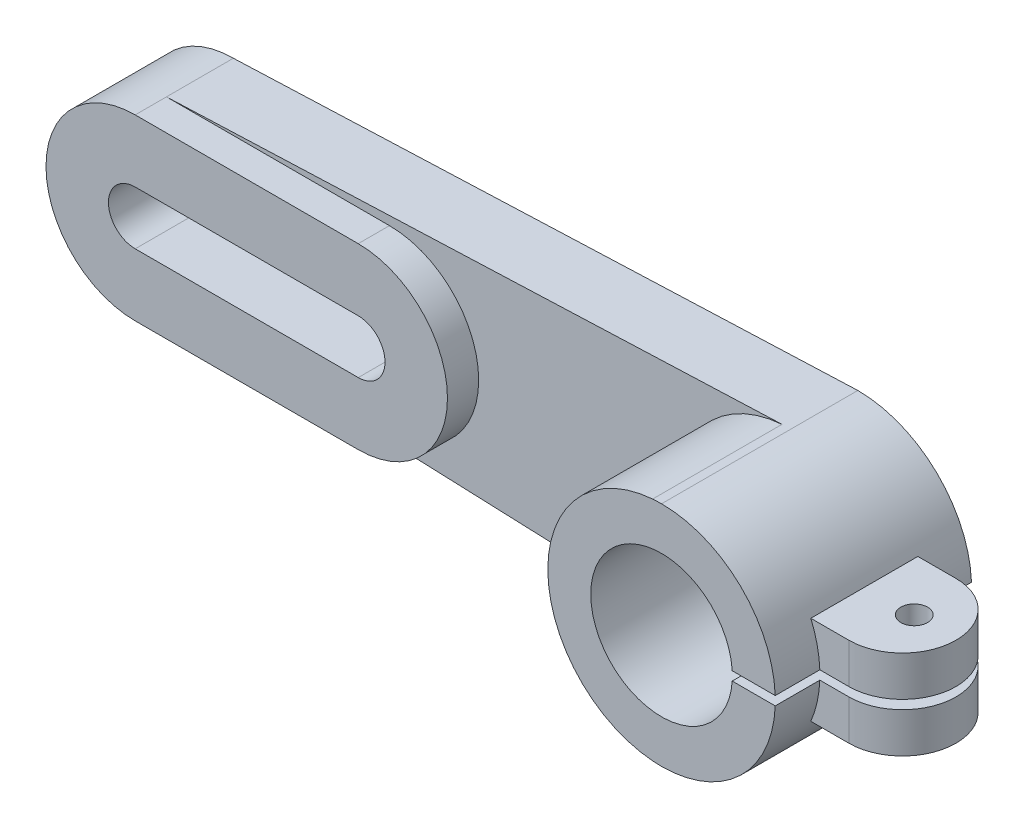
from build123d import *

# Parameters (mm, degrees)
BOSS_EXTRUDE1_DEPTH   = 44
BOSS_EXTRUDE2_DEPTH   = 15
BOSS_EXTRUDE3_DEPTH   = 22
BOSS_EXTRUDE4_START   = 10
BOSS_EXTRUDE4_DEPTH   = 24
FILLET3_RADIUS        = 12
FILLET3_LENGTH        = 9
FILLET4_RADIUS        = 12
FILLET4_LENGTH        = 9
F_6_0MM_DOWEL_HOLE1_D = 6


with BuildPart() as part:
    # Sketch1 → Boss-Extrude1 (new body)
    with BuildSketch(Plane.XY):
        with BuildLine():
            Line((0, 25.5), (-2.000483947, 25.421409559))
            ThreePointArc((-2.000483947, 25.421409559), (-25.5, 0), (-2.000483947, -25.421409559))
            Line((-2.000483947, -25.421409559), (0, -25.5))
            ThreePointArc((0, -25.5), (14.05791592, -21.274985311), (23.457408211, -10))
            ThreePointArc((23.457408211, -10), (24.879246203, -5.592236438), (25.480384612, -1))
            Line((25.480384612, -1), (15.838462678, -1))
            ThreePointArc((15.838462678, -1), (-15.87, 0), (15.838462678, 1))
            Line((15.838462678, 1), (25.480384612, 1))
            ThreePointArc((25.480384612, 1), (24.879246203, 5.592236438), (23.457408211, 10))
            ThreePointArc((23.457408211, 10), (14.05791592, 21.274985311), (0, 25.5))
        make_face()
    extrude(amount=BOSS_EXTRUDE1_DEPTH)

    # Sketch1<3> → Boss-Extrude2 (add)
    with BuildSketch(Plane.XY):
        with BuildLine():
            Line((-2.000483947, 25.421409559), (-140, 20))
            Line((-140, 20), (-90, 20))
            ThreePointArc((-90, 20), (-70, 0), (-90, -20))
            Line((-90, -20), (-140, -20))
            Line((-140, -20), (-2.000483947, -25.421409559))
            ThreePointArc((-2.000483947, -25.421409559), (-25.5, 0), (-2.000483947, 25.421409559))
        make_face()
    extrude(amount=BOSS_EXTRUDE2_DEPTH)

    # Sketch1<4> → Boss-Extrude3 (add)
    with BuildSketch(Plane.XY):
        with BuildLine():
            Line((-140, -20), (-90, -20))
            ThreePointArc((-90, -20), (-70, 0), (-90, 20))
            Line((-90, 20), (-140, 20))
            ThreePointArc((-140, 20), (-160, 0), (-140, -20))
        make_face()
        with BuildLine():
            ThreePointArc((-90, -6), (-84, 0), (-90, 6))
            Line((-90, 6), (-140, 6))
            ThreePointArc((-140, 6), (-146, 0), (-140, -6))
            Line((-140, -6), (-90, -6))
        make_face(mode=Mode.SUBTRACT)
    extrude(amount=BOSS_EXTRUDE3_DEPTH)

    # Sketch1<5> → Boss-Extrude4 (add)
    with BuildSketch(Plane.XY.offset(BOSS_EXTRUDE4_START)):
        with BuildLine():
            Line((44, 10), (23.457408211, 10))
            ThreePointArc((23.457408211, 10), (24.879246203, 5.592236438), (25.480384612, 1))
            Line((25.480384612, 1), (44, 1))
            Line((44, 1), (44, 10))
        make_face()
        with BuildLine():
            ThreePointArc((25.480384612, -1), (24.879246203, -5.592236438), (23.457408211, -10))
            Line((23.457408211, -10), (44, -10))
            Line((44, -10), (44, -1))
            Line((44, -1), (25.480384612, -1))
        make_face()
    extrude(amount=BOSS_EXTRUDE4_DEPTH)

    # Fillet3: full round fillet: the end face becomes a half cylinder, R = half its width
    fillet3_face = Plane((44, 5.5, 22), x_dir=(0, 1, 0), z_dir=(1, 0, 0))  # on the end face: x along it, z out of the body
    fillet3_slab = fillet3_face.offset(-FILLET3_RADIUS / 2) * Box(FILLET3_LENGTH, 2 * FILLET3_RADIUS, FILLET3_RADIUS, mode=Mode.PRIVATE)  # the body's end, R deep
    fillet3_round = Plane((32, 5.5, 22), x_dir=(1, 0, 0), z_dir=(0, 1, 0)) * Cylinder(FILLET3_RADIUS, FILLET3_LENGTH, mode=Mode.PRIVATE)  # its axis R under the face
    add(fillet3_slab - fillet3_round, mode=Mode.SUBTRACT)

    # Fillet4: full round fillet: the end face becomes a half cylinder, R = half its width
    fillet4_face = Plane((44, -5.5, 22), x_dir=(0, -1, 0), z_dir=(1, 0, 0))  # on the end face: x along it, z out of the body
    fillet4_slab = fillet4_face.offset(-FILLET4_RADIUS / 2) * Box(FILLET4_LENGTH, 2 * FILLET4_RADIUS, FILLET4_RADIUS, mode=Mode.PRIVATE)  # the body's end, R deep
    fillet4_round = Plane((32, -5.5, 22), x_dir=(1, 0, 0), z_dir=(0, -1, 0)) * Cylinder(FILLET4_RADIUS, FILLET4_LENGTH, mode=Mode.PRIVATE)  # its axis R under the face
    add(fillet4_slab - fillet4_round, mode=Mode.SUBTRACT)

    # Ø6.0mm Dowel Hole1 (through all)
    with Locations(Plane(origin=(34.387865252, 10, 21.746882561), x_dir=(1, 0, 0), z_dir=(0, 1, 0))):
        with Locations((0, 0)):
            Hole(F_6_0MM_DOWEL_HOLE1_D / 2)


solid = part.part
